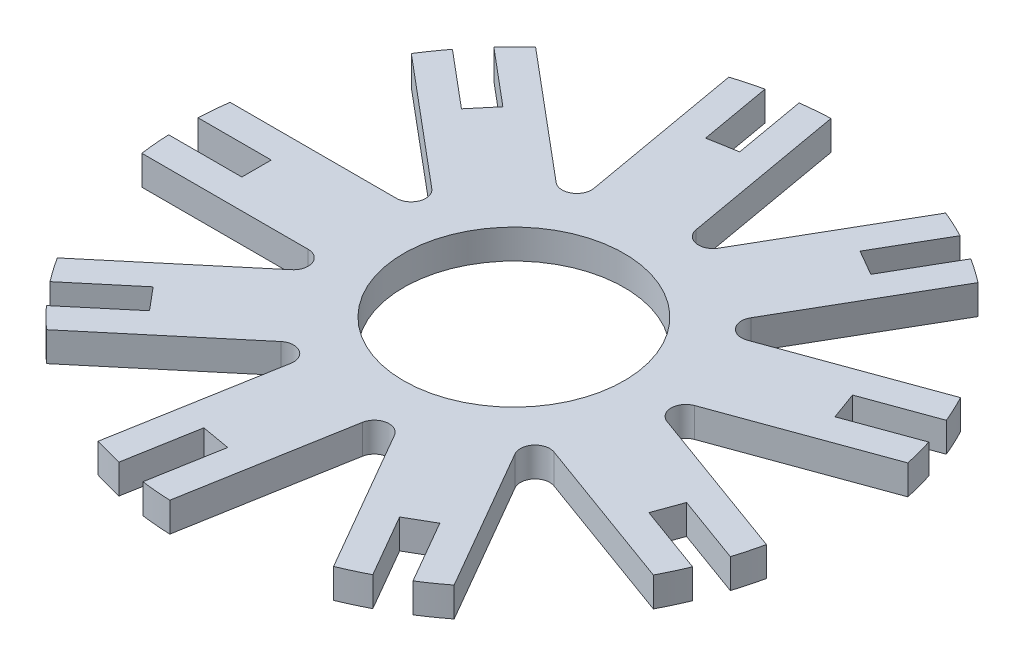
from build123d import *

# Parameters (mm, degrees)
BOSS_EXTRUDE3_DEPTH = 2
SKETCH6_W           = 10
SKETCH6_H           = 2
CUT_EXTRUDE4_DEPTH  = 2
CIRPATTERN3_COUNT   = 9
SKETCH7_R           = 7.5
CUT_EXTRUDE5_DEPTH  = 2


with BuildPart() as part:
    # Sketch1 → Boss-Extrude3 (new body)
    with BuildSketch(Plane(origin=(0, 0, 0), x_dir=(1, 0, 0), z_dir=(0, 1, 0))):
        with BuildLine():
            Line((-6.82662188, 21.439385106), (-4.862801047, 10.302003723))
            ThreePointArc((-4.862801047, 10.302003723), (-5.3476088, 9.262330141), (-6.49039641, 9.362311102))
            Line((-6.49039641, 9.362311102), (-15.153741203, 16.631720523))
            ThreePointArc((-15.153741203, 16.631720523), (-16.231142068, 15.582041817), (-17.23599997, 14.462721218))
            Line((-17.23599997, 14.462721218), (0, 0))
            Line((0, 0), (-22.5, 0))
            ThreePointArc((-22.5, 0), (-22.4497196, -1.503359534), (-22.299103121, -3))
            Line((-22.299103121, -3), (-10.989909678, -3))
            ThreePointArc((-10.989909678, -3), (-10.050217057, -3.657979857), (-10.347122068, -4.766044443))
            Line((-10.347122068, -4.766044443), (-19.010466861, -12.035453864))
            ThreePointArc((-19.010466861, -12.035453864), (-17.23599997, -14.462721218), (-15.153741203, -16.631720523))
            Line((-15.153741203, -16.631720523), (-6.49039641, -9.362311102))
            ThreePointArc((-6.49039641, -9.362311102), (-5.3476088, -9.262330141), (-4.862801047, -10.302003723))
            Line((-4.862801047, -10.302003723), (-6.82662188, -21.439385106))
            ThreePointArc((-6.82662188, -21.439385106), (-3.907083998, -22.158174443), (-0.917775362, -22.481274172))
            Line((-0.917775362, -22.481274172), (1.046045471, -11.343892789))
            ThreePointArc((1.046045471, -11.343892789), (1.857205046, -10.532733213), (2.896878628, -11.017540966))
            Line((2.896878628, -11.017540966), (8.551475349, -20.811589784))
            ThreePointArc((8.551475349, -20.811589784), (11.25, -19.485571585), (13.747627772, -17.811589784))
            Line((13.747627772, -17.811589784), (8.09303105, -8.017540966))
            ThreePointArc((8.09303105, -8.017540966), (8.193012011, -6.874753357), (9.301076597, -6.577848346))
            Line((9.301076597, -6.577848346), (19.928242223, -10.445820308))
            ThreePointArc((19.928242223, -10.445820308), (21.143083968, -7.695453225), (21.980363083, -4.807664583))
            Line((21.980363083, -4.807664583), (11.353197457, -0.939692621))
            ThreePointArc((11.353197457, -0.939692621), (10.695217601, 0), (11.353197457, 0.939692621))
            Line((11.353197457, 0.939692621), (21.980363083, 4.807664583))
            ThreePointArc((21.980363083, 4.807664583), (21.143083968, 7.695453225), (19.928242223, 10.445820308))
            Line((19.928242223, 10.445820308), (9.301076597, 6.577848346))
            ThreePointArc((9.301076597, 6.577848346), (8.193012011, 6.874753357), (8.09303105, 8.017540966))
            Line((8.09303105, 8.017540966), (13.747627772, 17.811589784))
            ThreePointArc((13.747627772, 17.811589784), (11.25, 19.485571585), (8.551475349, 20.811589784))
            Line((8.551475349, 20.811589784), (2.896878628, 11.017540966))
            ThreePointArc((2.896878628, 11.017540966), (1.857205046, 10.532733213), (1.046045471, 11.343892789))
            Line((1.046045471, 11.343892789), (-0.917775362, 22.481274172))
            ThreePointArc((-0.917775362, 22.481274172), (-3.907083998, 22.158174443), (-6.82662188, 21.439385106))
        make_face()
        with BuildLine():
            Line((0, 0), (-17.23599997, 14.462721218))
            ThreePointArc((-17.23599997, 14.462721218), (-18.163823831, 13.278761383), (-19.010466861, 12.035453864))
            Line((-19.010466861, 12.035453864), (-10.347122068, 4.766044443))
            ThreePointArc((-10.347122068, 4.766044443), (-10.050217057, 3.657979857), (-10.989909678, 3))
            Line((-10.989909678, 3), (-22.299103121, 3))
            ThreePointArc((-22.299103121, 3), (-22.4497196, 1.503359534), (-22.5, 0))
            Line((-22.5, 0), (0, 0))
        make_face()
    extrude(amount=BOSS_EXTRUDE3_DEPTH)

    # Sketch6 → Cut-Extrude4 (cut)
    with BuildSketch(Plane(origin=(0, 2, 0), x_dir=(1, 0, 0), z_dir=(0, 1, 0))):
        with Locations((-22.5, 0)):
            Rectangle(SKETCH6_W, SKETCH6_H)
    cut_extrude4 = extrude(amount=-CUT_EXTRUDE4_DEPTH, mode=Mode.SUBTRACT)

    # CirPattern3: Cut-Extrude4 ×9 about axis
    cirpattern3_axis = Axis((0, 0, 0), (0, 1, 0))
    for i in range(1, CIRPATTERN3_COUNT):
        add(cut_extrude4.rotate(cirpattern3_axis, i * 360 / CIRPATTERN3_COUNT), mode=Mode.SUBTRACT)

    # Sketch7 → Cut-Extrude5 (cut)
    with BuildSketch(Plane(origin=(0, 2, 0), x_dir=(1, 0, 0), z_dir=(0, 1, 0))):
        with Locations(Location((0, 0, 0), (0, 0, 270))):
            Circle(SKETCH7_R)
    extrude(amount=-CUT_EXTRUDE5_DEPTH, mode=Mode.SUBTRACT)


solid = part.part
